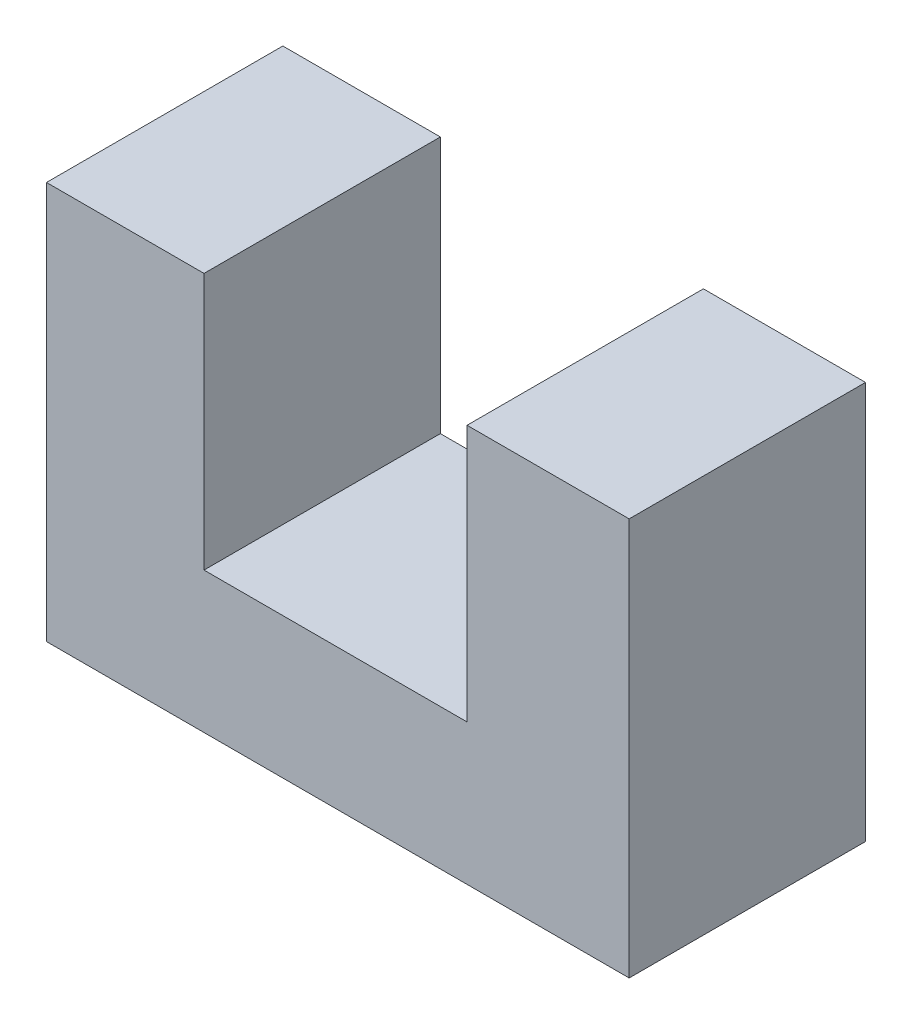
from build123d import *

# Parameters (mm, degrees)
BOSS_EXTRUDE1_DEPTH = 28.194


with BuildPart() as part:
    # Sketch1 → Boss-Extrude1 (new body)
    with BuildSketch(Plane.XY):
        Polygon((0, 0), (69.510220161, 0), (69.510220161, 47.434795911), (50.171418752, 47.434795911), (50.171418752, 16.784620091), (18.791476842, 16.784620091), (18.791476842, 47.434795911), (0, 47.434795911), align=None)
    extrude(amount=BOSS_EXTRUDE1_DEPTH)


solid = part.part
